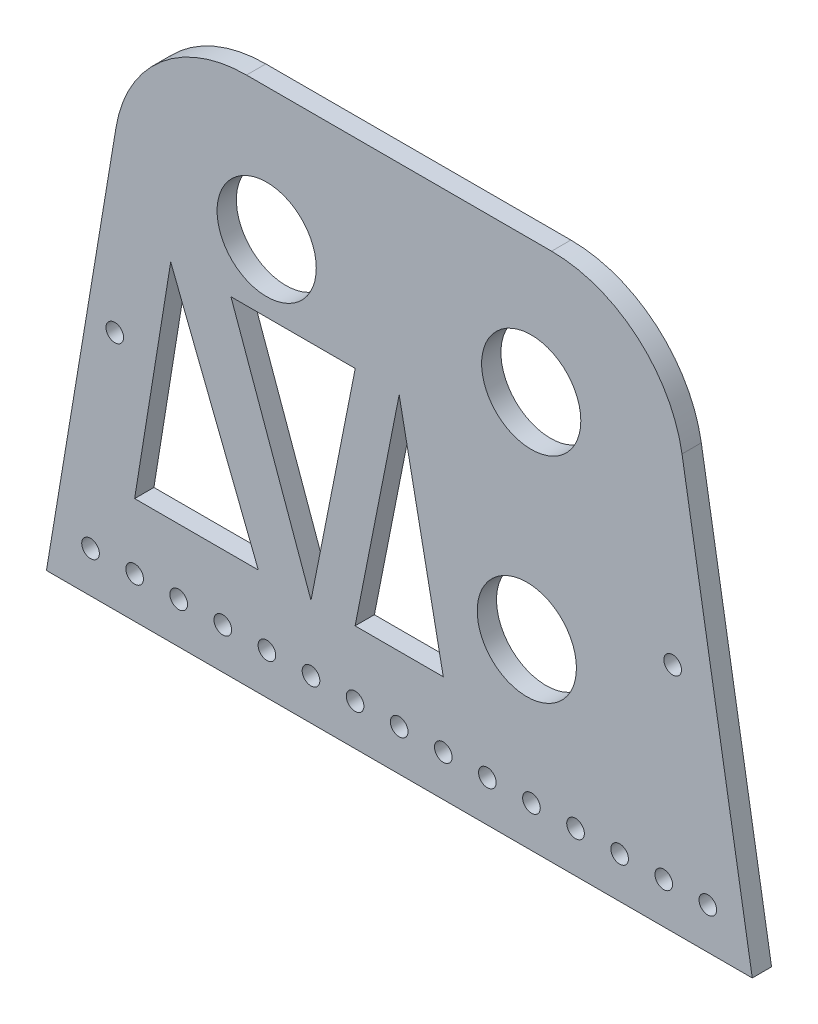
from build123d import *

# Parameters (mm, degrees)
SKETCH2_R           = 14.2875
SKETCH2_R_2         = 2.54
BOSS_EXTRUDE1_DEPTH = 5.55625
FILLET1_R           = 38.1


with BuildPart() as part:
    # Sketch2 → Boss-Extrude1 (new body)
    with BuildSketch(Plane.XY):
        Polygon((-33.221954044, -123.033671084), (-58.55568732, -123.033671084), (-33.221954044, 29.366328916), (119.178045956, 29.366328916), (144.745882617, -123.033671084), (119.178045956, -123.033671084), align=None)
        with Locations((4.878045956, -8.733671084)):
            Circle(SKETCH2_R, mode=Mode.SUBTRACT)
        with Locations((81.078045956, -8.733671084)):
            Circle(SKETCH2_R, mode=Mode.SUBTRACT)
        with Locations((-45.85568732, -111.187710863)):
            Circle(SKETCH2_R_2, mode=Mode.SUBTRACT)
        with Locations((-33.15568732, -111.187710863)):
            Circle(SKETCH2_R_2, mode=Mode.SUBTRACT)
        with Locations((-20.45568732, -111.187710863)):
            Circle(SKETCH2_R_2, mode=Mode.SUBTRACT)
        with Locations((-7.75568732, -111.187710863)):
            Circle(SKETCH2_R_2, mode=Mode.SUBTRACT)
        with Locations((4.94431268, -111.187710863)):
            Circle(SKETCH2_R_2, mode=Mode.SUBTRACT)
        with Locations((17.64431268, -111.187710863)):
            Circle(SKETCH2_R_2, mode=Mode.SUBTRACT)
        with Locations((30.34431268, -111.187710863)):
            Circle(SKETCH2_R_2, mode=Mode.SUBTRACT)
        with Locations((43.04431268, -111.187710863)):
            Circle(SKETCH2_R_2, mode=Mode.SUBTRACT)
        with Locations((55.74431268, -111.187710863)):
            Circle(SKETCH2_R_2, mode=Mode.SUBTRACT)
        with Locations((68.44431268, -111.187710863)):
            Circle(SKETCH2_R_2, mode=Mode.SUBTRACT)
        with Locations((81.14431268, -111.187710863)):
            Circle(SKETCH2_R_2, mode=Mode.SUBTRACT)
        with Locations((93.84431268, -111.187710863)):
            Circle(SKETCH2_R_2, mode=Mode.SUBTRACT)
        with Locations((106.54431268, -111.187710863)):
            Circle(SKETCH2_R_2, mode=Mode.SUBTRACT)
        with Locations((119.24431268, -111.187710863)):
            Circle(SKETCH2_R_2, mode=Mode.SUBTRACT)
        with Locations((131.94431268, -111.187710863)):
            Circle(SKETCH2_R_2, mode=Mode.SUBTRACT)
        with Locations((79.809453324, -71.051356873)):
            Circle(SKETCH2_R, mode=Mode.SUBTRACT)
        with Locations((121.810607633, -56.370137575)):
            Circle(SKETCH2_R_2, mode=Mode.SUBTRACT)
        with Locations((-38.87409027, -53.830137575)):
            Circle(SKETCH2_R_2, mode=Mode.SUBTRACT)
        Polygon((-22.767796965, -28.16783361), (-33.15568732, -92.394571291), (2.468038836, -92.394571291), align=None, mode=Mode.SUBTRACT)
        Polygon((43.04431268, -28.399699089), (55.74431268, -92.394571291), (30.34431268, -92.394571291), align=None, mode=Mode.SUBTRACT)
        Polygon((17.64431268, -92.394571291), (30.390327173, -28.16783361), (-5.41538745, -28.16783361), align=None, mode=Mode.SUBTRACT)
    extrude(amount=BOSS_EXTRUDE1_DEPTH)

    # Fillet1
    fillet1_edges = [part.edges().sort_by_distance(p)[0] for p in [
        (-33.221954044, 29.366328916, 2.778125),
        (119.178045956, 29.366328916, 2.778125),
    ]]
    fillet(fillet1_edges, radius=FILLET1_R)


solid = part.part
